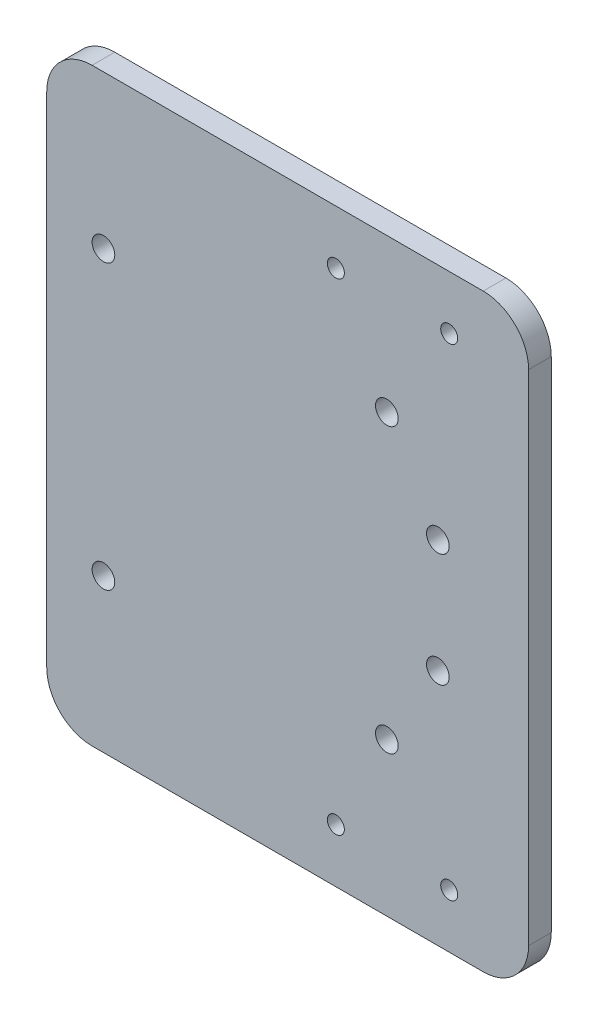
from build123d import *

# Parameters (mm, degrees)
SKETCH_1_W      = 85
SKETCH_1_H      = 104
SKETCH_1_R      = 2
SKETCH_1_R_2    = 1.5
EXTRUDE_1_DEPTH = 4
FILLET_1_R      = 8


with BuildPart() as part:
    # 草图1 → 凸台-拉伸1 (new body)
    with BuildSketch(Plane.XY):
        with Locations((-13.600288588, -10.520274333)):
            Rectangle(SKETCH_1_W, SKETCH_1_H)
        with Locations((12.899711412, -0.520274333)):
            Circle(SKETCH_1_R, mode=Mode.SUBTRACT)
        with Locations((12.899711412, -20.520274333)):
            Circle(SKETCH_1_R, mode=Mode.SUBTRACT)
        with Locations((-46.100288588, 14.479725667)):
            Circle(SKETCH_1_R, mode=Mode.SUBTRACT)
        with Locations((-46.100288588, -35.520274333)):
            Circle(SKETCH_1_R, mode=Mode.SUBTRACT)
        with Locations((3.899711412, -35.520274333)):
            Circle(SKETCH_1_R, mode=Mode.SUBTRACT)
        with Locations((3.899711412, 14.479725667)):
            Circle(SKETCH_1_R, mode=Mode.SUBTRACT)
        with Locations((-5.100288588, 31.979725667)):
            Circle(SKETCH_1_R_2, mode=Mode.SUBTRACT)
        with Locations((14.899711412, 31.979725667)):
            Circle(SKETCH_1_R_2, mode=Mode.SUBTRACT)
        with Locations((-5.100288588, -53.020274333)):
            Circle(SKETCH_1_R_2, mode=Mode.SUBTRACT)
        with Locations((14.899711412, -53.020274333)):
            Circle(SKETCH_1_R_2, mode=Mode.SUBTRACT)
    extrude(amount=EXTRUDE_1_DEPTH)

    # 圆角1
    fillet_1_edges = [part.edges().sort_by_distance(p)[0] for p in [
        (28.899711412, -62.520274333, 2),
        (-56.100288588, -62.520274333, 2),
        (-56.100288588, 41.479725667, 2),
        (28.899711412, 41.479725667, 2),
    ]]
    fillet(fillet_1_edges, radius=FILLET_1_R)


solid = part.part
